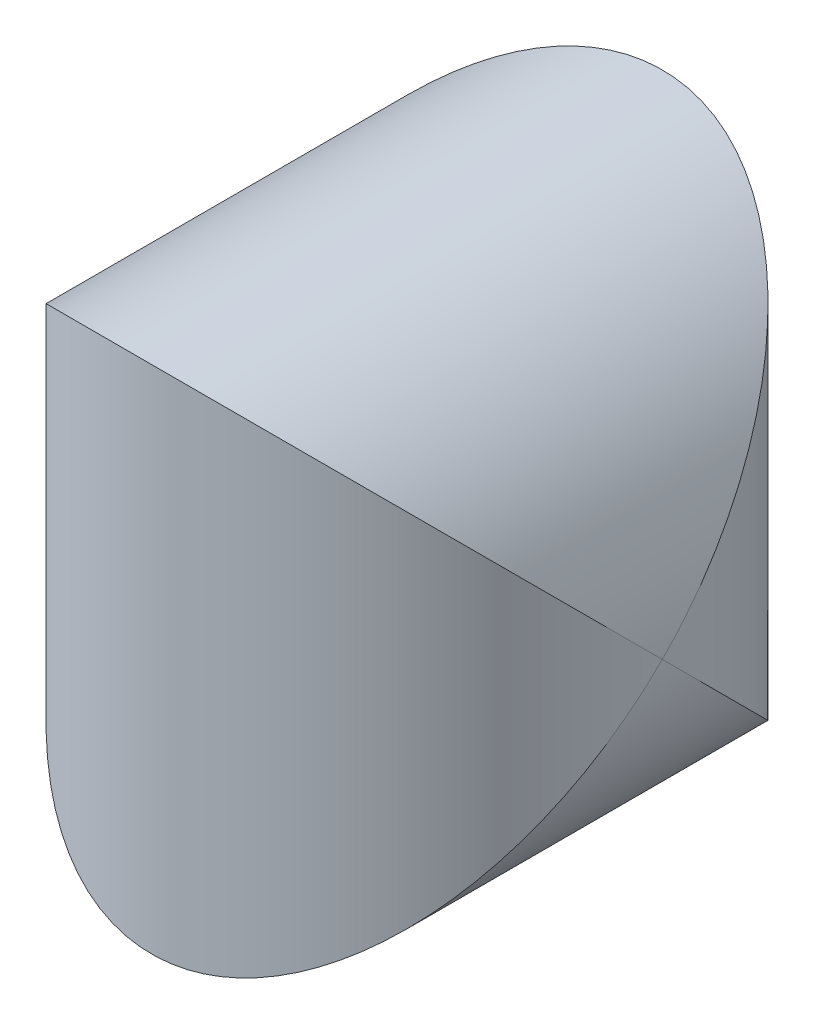
from build123d import *

# Parameters (mm, degrees)
SKETCH_1_R          = 25
EXTRUDE_1_DEPTH     = 25
SKETCH_2_OUTSIDE_W  = 69.32
SKETCH_2_OUTSIDE_H  = 69.32
SKETCH_2_OUTSIDE_R  = 25
CUT_EXTRUDE_1_DEPTH = 40


with BuildPart() as part:
    # 草图1 → 凸台-拉伸1 (new, symmetric)
    with BuildSketch(Plane(origin=(0, 0, 0), x_dir=(1, 0, 0), z_dir=(0, 1, 0))):
        with Locations(Location((0, 0, 0), (0, 0, 270))):
            Circle(SKETCH_1_R)
    extrude(amount=EXTRUDE_1_DEPTH, both=True)

    # 草图2 outside → 切除-拉伸1 (cut, symmetric)
    with BuildSketch(Plane.XY):
        Rectangle(SKETCH_2_OUTSIDE_W, SKETCH_2_OUTSIDE_H)
        Circle(SKETCH_2_OUTSIDE_R, mode=Mode.SUBTRACT)
    extrude(amount=CUT_EXTRUDE_1_DEPTH, both=True, mode=Mode.SUBTRACT)


solid = part.part
